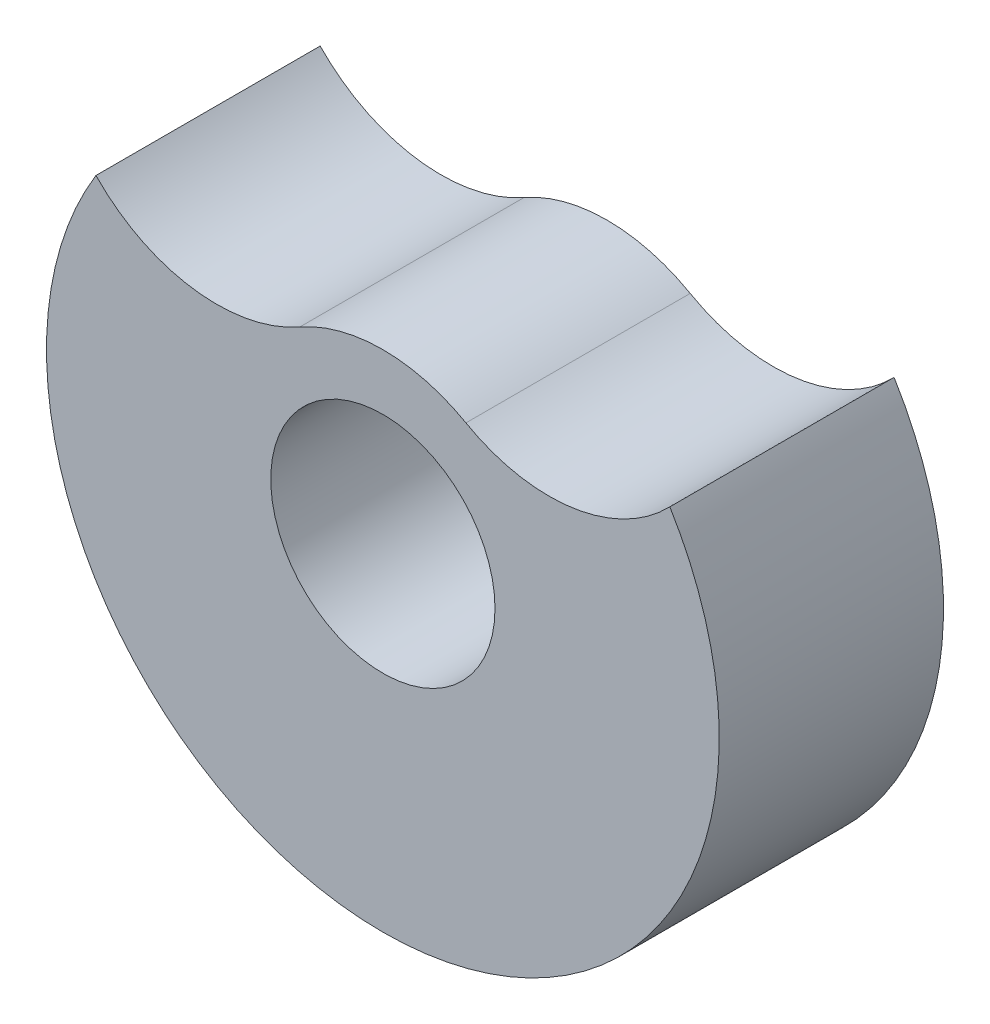
from build123d import *

# Parameters (mm, degrees)
SKETCH2_R           = 15
BOSS_EXTRUDE1_DEPTH = 10
CUT_EXTRUDE1_REACH  = 25.452
SKETCH3_R           = 5
CUT_EXTRUDE2_DEPTH  = 24.452078799


with BuildPart() as part:
    # Sketch2 → Boss-Extrude1 (new body)
    with BuildSketch(Plane.XY):
        Circle(SKETCH2_R)
    extrude(amount=BOSS_EXTRUDE1_DEPTH)

    # Sketch3 → Cut-Extrude1 (cut, up to next)
    with BuildSketch(Plane.XY.offset(10), mode=Mode.PRIVATE) as cut_extrude1_sk1:
        Circle(SKETCH3_R)
    cut_extrude1_tool1 = extrude(cut_extrude1_sk1.sketch, amount=-CUT_EXTRUDE1_REACH, mode=Mode.PRIVATE) & part.part
    add(cut_extrude1_tool1.solids().sort_by_distance((0, 0, 10))[0], mode=Mode.SUBTRACT)

    # Sketch7 → Cut-Extrude2 (cut, through all)
    with BuildSketch(Plane.XY.offset(10)):
        with BuildLine():
            ThreePointArc((3.70412729, 6.521460037), (0, 7.5), (-3.70412729, 6.521460037))
            ThreePointArc((-3.70412729, 6.521460037), (-14.165401159, 16.297297145), (0, 14.212434533))
            ThreePointArc((0, 14.212434533), (14.165401159, 16.297297145), (3.70412729, 6.521460037))
        make_face()
    extrude(amount=-CUT_EXTRUDE2_DEPTH, mode=Mode.SUBTRACT)


with BuildPart() as body_2:
    # of the pieces the cut leaves, the one that is kept (cut_extrude2_keep)
    add(part.part.solids().sort_by_distance((-12.796599287, 7.826049238, 0))[0])


solid = body_2.part
